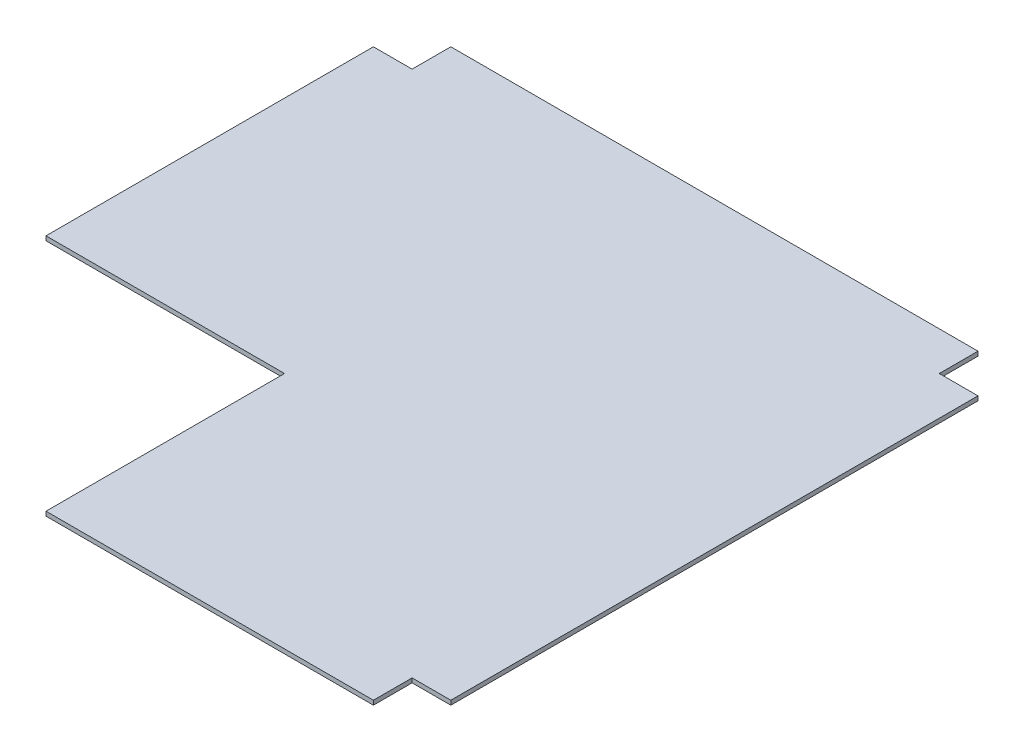
from build123d import *

# Parameters (mm, degrees)
BOSS_EXTRUDE1_DEPTH = 3.175


with BuildPart() as part:
    # Sketch1 → Boss-Extrude1 (new body)
    with BuildSketch(Plane(origin=(0, 0, 0), x_dir=(1, 0, 0), z_dir=(0, 1, 0))):
        Polygon((175, 175), (175, 0), (415.25, 0), (415.25, 28.4), (443.65, 28.4), (443.65, 415.25), (415.25, 415.25), (415.25, 443.65), (28.4, 443.65), (28.4, 415.25), (0, 415.25), (0, 175), align=None)
    extrude(amount=BOSS_EXTRUDE1_DEPTH)


solid = part.part
